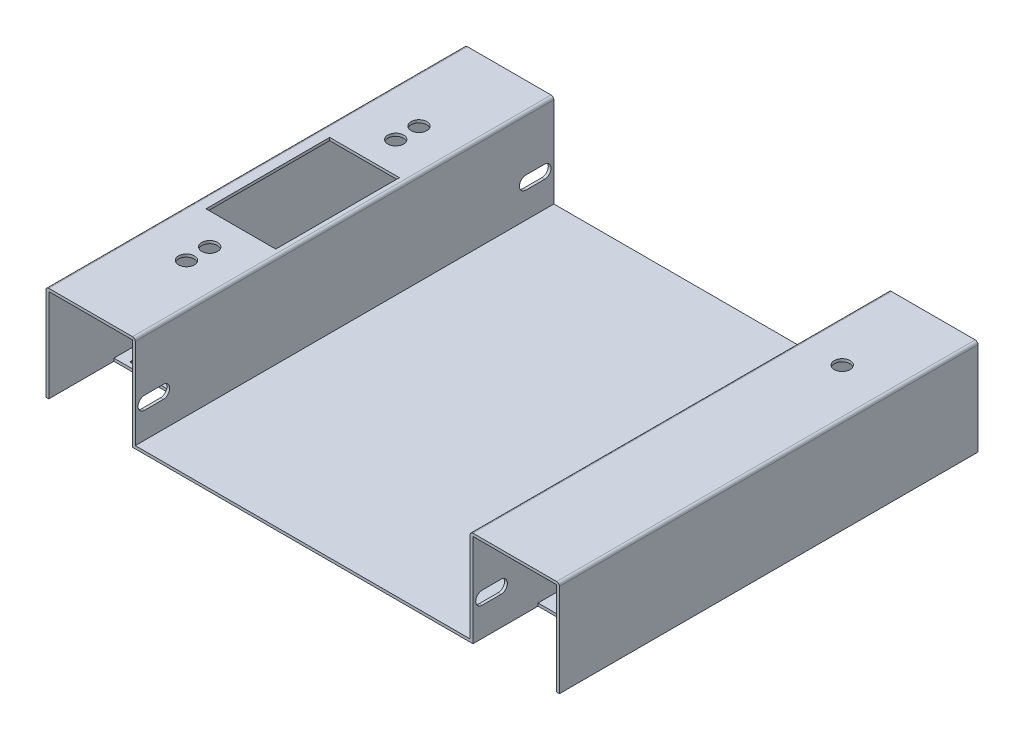
from build123d import *

# Parameters (mm, degrees)
SKETCH1_W                      = 552
SKETCH1_H                      = 450
BOSS_EXTRUDE1_DEPTH            = 100
SKETCH2_W                      = 97
SKETCH2_H                      = 450
CUT_EXTRUDE1_DEPTH             = 90
SKETCH3_W                      = 450
SKETCH3_H                      = 97
CUT_EXTRUDE2_DEPTH             = 90
BOSS_EXTRUDE2_DEPTH            = 3
SKETCH5_W                      = 360
SKETCH5_H                      = 100
CUT_EXTRUDE3_DEPTH             = 542.403325206
SKETCH6_W                      = 20
SKETCH6_H                      = 3
BOSS_EXTRUDE3_DEPTH            = 90
SKETCH7_W                      = 20
SKETCH7_H                      = 3
BOSS_EXTRUDE4_DEPTH            = 90
CUT_EXTRUDE4_REACH             = 653.826
SKETCH9_W                      = 75
SKETCH9_H                      = 133
CUT_EXTRUDE5_DEPTH             = 538.285771261
CUT_EXTRUDE6_REACH             = 655.929
CUT_EXTRUDE7_REACH             = 653.826
CUT_EXTRUDE8_REACH             = 655.929
SKETCH13_W                     = 56
SKETCH13_H                     = 10
CUT_EXTRUDE9_DEPTH             = 1
SKETCH14_W                     = 56
SKETCH14_H                     = 10
CUT_EXTRUDE10_DEPTH            = 1
SKETCH15_W                     = 56
SKETCH15_H                     = 10
CUT_EXTRUDE11_DEPTH            = 1
SKETCH16_W                     = 56
SKETCH16_H                     = 10
CUT_EXTRUDE12_DEPTH            = 1
F_3_3_3_3_DIAMETER_HOLE1_D     = 3.3
F_3_3_3_3_DIAMETER_HOLE1_DEPTH = 2
F_17_0_17_DIAMETER_HOLE1_D     = 17
F_17_0_17_DIAMETER_HOLE1_DEPTH = 3
F_17_0_17_DIAMETER_HOLE2_D     = 17
F_17_0_17_DIAMETER_HOLE2_DEPTH = 103
FILLET1_R                      = 3


with BuildPart() as part:
    # Sketch1 → Boss-Extrude1 (new body)
    with BuildSketch(Plane(origin=(0, 120.173044165, 0), x_dir=(1, 0, 0), z_dir=(0, 1, 0))):
        with Locations((0, -225)):
            Rectangle(SKETCH1_W, SKETCH1_H)
    extrude(amount=-BOSS_EXTRUDE1_DEPTH)

    # Sketch2 → Cut-Extrude1 (cut)
    with BuildSketch(Plane(origin=(-273, 0, 0), x_dir=(0, -1, 0), z_dir=(-1, 0, 0))):
        with Locations((-68.673044165, 225)):
            Rectangle(SKETCH2_W, SKETCH2_H)
    extrude(amount=-CUT_EXTRUDE1_DEPTH, mode=Mode.SUBTRACT)

    # Sketch3 → Cut-Extrude2 (cut)
    with BuildSketch(Plane(origin=(273, 0, 0), x_dir=(0, 0, -1), z_dir=(1, 0, 0))):
        with Locations((-225, 68.673044165)):
            Rectangle(SKETCH3_W, SKETCH3_H)
    extrude(amount=-CUT_EXTRUDE2_DEPTH, mode=Mode.SUBTRACT)

    # Sketch4 → Boss-Extrude2 (add)
    with BuildSketch(Plane.XZ.offset(-20.173044165)):
        Polygon((-273, 360), (-273, 0), (-276, 0), (-276, 450), (-273, 450), (-273, 380), (-183, 380), (-183, 450), (183, 450), (183, 90), (273, 90), (273, 450), (276, 450), (276, 0), (273, 0), (273, 70), (183, 70), (183, 0), (-183, 0), (-183, 360), align=None)
    extrude(amount=BOSS_EXTRUDE2_DEPTH)

    # Sketch5 → Cut-Extrude3 (cut, through all)
    with BuildSketch(Plane(origin=(0, 0, 0), x_dir=(-1, 0, 0), z_dir=(0, 0, -1))):
        with Locations((0, 70.173044165)):
            Rectangle(SKETCH5_W, SKETCH5_H)
    extrude(amount=-CUT_EXTRUDE3_DEPTH, mode=Mode.SUBTRACT)

    # Sketch6 → Boss-Extrude3 (add)
    with BuildSketch(Plane(origin=(-273, 0, 0), x_dir=(0, 0, -1), z_dir=(1, 0, 0))):
        with Locations((-80, 18.673044165)):
            Rectangle(SKETCH6_W, SKETCH6_H)
    extrude(amount=BOSS_EXTRUDE3_DEPTH)

    # Sketch7 → Boss-Extrude4 (add)
    with BuildSketch(Plane.ZY.offset(-273)):
        with Locations((370, 18.673044165)):
            Rectangle(SKETCH7_W, SKETCH7_H)
    extrude(amount=BOSS_EXTRUDE4_DEPTH)

    # Sketch8 → Cut-Extrude4 (cut, up to next)
    with BuildSketch(Plane(origin=(-180, 0, 0), x_dir=(0, 0, -1), z_dir=(1, 0, 0)), mode=Mode.PRIVATE) as cut_extrude4_sk1:
        with BuildLine():
            Line((-440, 48.173044165), (-420, 48.173044165))
            ThreePointArc((-420, 48.173044165), (-413, 55.173044165), (-420, 62.173044165))
            Line((-420, 62.173044165), (-440, 62.173044165))
            ThreePointArc((-440, 62.173044165), (-447, 55.173044165), (-440, 48.173044165))
        make_face()
    cut_extrude4_tool1 = extrude(cut_extrude4_sk1.sketch, amount=-CUT_EXTRUDE4_REACH, mode=Mode.PRIVATE) & part.part
    add(cut_extrude4_tool1.solids().sort_by_distance((-180, 55.173044, 430))[0], mode=Mode.SUBTRACT)

    # Sketch9 → Cut-Extrude5 (cut, through all)
    with BuildSketch(Plane.XZ.offset(-117.173044165)):
        with Locations((-225, 225)):
            Rectangle(SKETCH9_W, SKETCH9_H)
    extrude(amount=-CUT_EXTRUDE5_DEPTH, mode=Mode.SUBTRACT)

    # Sketch10 → Cut-Extrude6 (cut, up to next)
    with BuildSketch(Plane.ZY.offset(183), mode=Mode.PRIVATE) as cut_extrude6_sk1:
        with BuildLine():
            Line((10, 48.173044165), (30, 48.173044165))
            ThreePointArc((30, 48.173044165), (37, 55.173044165), (30, 62.173044165))
            Line((30, 62.173044165), (10, 62.173044165))
            ThreePointArc((10, 62.173044165), (3, 55.173044165), (10, 48.173044165))
        make_face()
    cut_extrude6_tool1 = extrude(cut_extrude6_sk1.sketch, amount=-CUT_EXTRUDE6_REACH, mode=Mode.PRIVATE) & part.part
    add(cut_extrude6_tool1.solids().sort_by_distance((-183, 55.173044, 20))[0], mode=Mode.SUBTRACT)

    # Sketch11 → Cut-Extrude7 (cut, up to next)
    with BuildSketch(Plane.ZY.offset(-180), mode=Mode.PRIVATE) as cut_extrude7_sk1:
        with BuildLine():
            Line((440, 62.173044165), (420, 62.173044165))
            ThreePointArc((420, 62.173044165), (413, 55.173044165), (420, 48.173044165))
            Line((420, 48.173044165), (440, 48.173044165))
            ThreePointArc((440, 48.173044165), (447, 55.173044165), (440, 62.173044165))
        make_face()
    cut_extrude7_tool1 = extrude(cut_extrude7_sk1.sketch, amount=-CUT_EXTRUDE7_REACH, mode=Mode.PRIVATE) & part.part
    add(cut_extrude7_tool1.solids().sort_by_distance((180, 55.173044, 430))[0], mode=Mode.SUBTRACT)

    # Sketch12 → Cut-Extrude8 (cut, up to next)
    with BuildSketch(Plane(origin=(183, 0, 0), x_dir=(0, 0, -1), z_dir=(1, 0, 0)), mode=Mode.PRIVATE) as cut_extrude8_sk1:
        with BuildLine():
            Line((-10, 62.173044165), (-30, 62.173044165))
            ThreePointArc((-30, 62.173044165), (-37, 55.173044165), (-30, 48.173044165))
            Line((-30, 48.173044165), (-10, 48.173044165))
            ThreePointArc((-10, 48.173044165), (-3, 55.173044165), (-10, 62.173044165))
        make_face()
    cut_extrude8_tool1 = extrude(cut_extrude8_sk1.sketch, amount=-CUT_EXTRUDE8_REACH, mode=Mode.PRIVATE) & part.part
    add(cut_extrude8_tool1.solids().sort_by_distance((183, 55.173044, 20))[0], mode=Mode.SUBTRACT)

    # Sketch13 → Cut-Extrude9 (cut)
    with BuildSketch(Plane(origin=(0, 20.173044165, 0), x_dir=(-1, 0, 0), z_dir=(0, 1, 0))):
        with Locations((233, 80)):
            Rectangle(SKETCH13_W, SKETCH13_H)
    extrude(amount=-CUT_EXTRUDE9_DEPTH, mode=Mode.SUBTRACT)

    # Sketch14 → Cut-Extrude10 (cut)
    with BuildSketch(Plane(origin=(0, 20.173044165, 0), x_dir=(-1, 0, 0), z_dir=(0, 1, 0))):
        with Locations((233, 370)):
            Rectangle(SKETCH14_W, SKETCH14_H)
    extrude(amount=-CUT_EXTRUDE10_DEPTH, mode=Mode.SUBTRACT)

    # Sketch15 → Cut-Extrude11 (cut)
    with BuildSketch(Plane(origin=(0, 20.173044165, 0), x_dir=(-1, 0, 0), z_dir=(0, 1, 0))):
        with Locations((-233, 370)):
            Rectangle(SKETCH15_W, SKETCH15_H)
    extrude(amount=-CUT_EXTRUDE11_DEPTH, mode=Mode.SUBTRACT)

    # Sketch16 → Cut-Extrude12 (cut)
    with BuildSketch(Plane(origin=(0, 20.173044165, 0), x_dir=(-1, 0, 0), z_dir=(0, 1, 0))):
        with Locations((-233, 80)):
            Rectangle(SKETCH16_W, SKETCH16_H)
    extrude(amount=-CUT_EXTRUDE12_DEPTH, mode=Mode.SUBTRACT)

    # Ø3.3 (3.3) Diameter Hole1
    with Locations(Plane(origin=(0, 19.173044165, 0), x_dir=(1, 0, 0), z_dir=(0, 1, 0))):
        with Locations((-254.5, -80), (-211.5, -80), (-254.5, -370), (-211.5, -370), (211.5, -370), (254.5, -370), (211.5, -80), (254.5, -80)):
            Hole(F_3_3_3_3_DIAMETER_HOLE1_D / 2, depth=F_3_3_3_3_DIAMETER_HOLE1_DEPTH)

    # Ø17.0 (17) Diameter Hole1
    with Locations(Plane(origin=(0, 120.173044165, 0), x_dir=(1, 0, 0), z_dir=(0, 1, 0))):
        with Locations((225, -95)):
            Hole(F_17_0_17_DIAMETER_HOLE1_D / 2, depth=F_17_0_17_DIAMETER_HOLE1_DEPTH)

    # Ø17.0 (17) Diameter Hole2
    with Locations(Plane(origin=(0, 120.173044165, 0), x_dir=(1, 0, 0), z_dir=(0, 1, 0))):
        with Locations((-225, -100), (-225, -125), (-225, -325), (-225, -350)):
            Hole(F_17_0_17_DIAMETER_HOLE2_D / 2, depth=F_17_0_17_DIAMETER_HOLE2_DEPTH)

    # Fillet1
    fillet1_edges = [part.edges().sort_by_distance(p)[0] for p in [
        (-180, 120.173044165, 225),
        (180, 120.173044165, 225),
        (276, 120.173044165, 225),
        (-276, 120.173044165, 225),
    ]]
    fillet(fillet1_edges, radius=FILLET1_R)


solid = part.part
